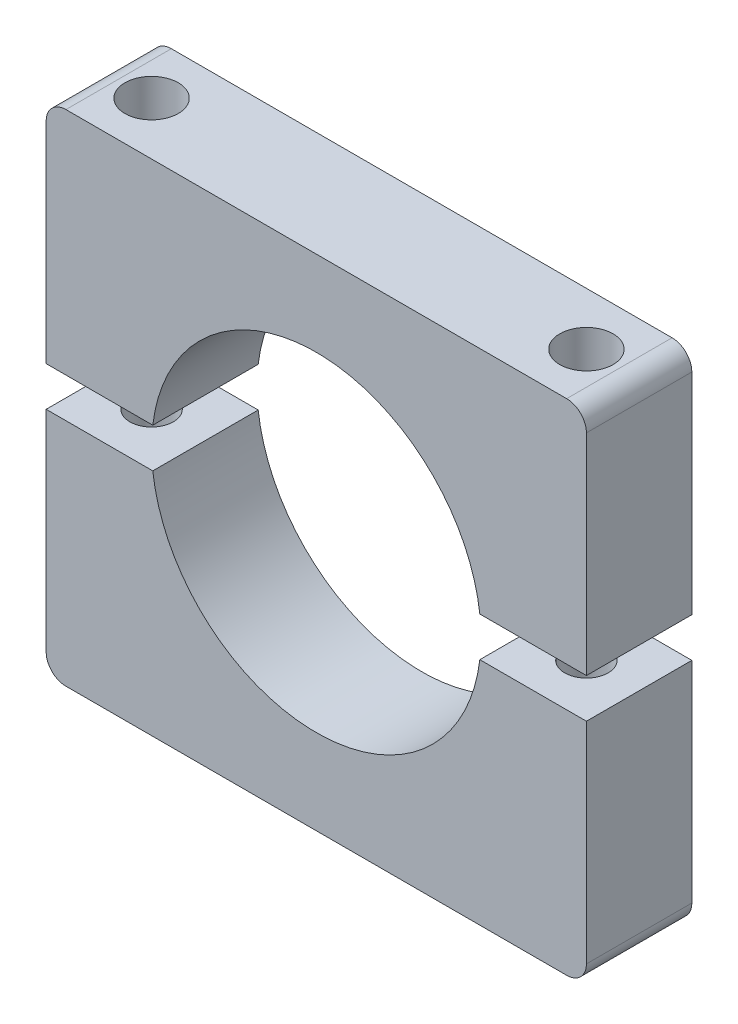
from build123d import *

# Parameters (mm, degrees)
SKETCH_1_W                  = 41
SKETCH_1_H                  = 37.9
SKETCH_1_R                  = 12.5
EXTRUDE_1_DEPTH             = 4
FILLET_1_R                  = 1.5
SKETCH_2_W                  = 50
SKETCH_2_H                  = 3
CUT_EXTRUDE_1_DEPTH         = 19
SKETCH_3_R                  = 2.025
CUT_EXTRUDE_2_DEPTH         = 19
SKETCH_5_W                  = 1.65
SKETCH_5_H                  = 17.45
HOLE_WIZARD_M4_1_AT_2_COUNT = 2
HOLE_WIZARD_M4_1_AT_2_PITCH = 33


with BuildPart() as part:
    # 草图1 → 凸台-拉伸1 (new, symmetric)
    with BuildSketch(Plane.XY):
        Rectangle(SKETCH_1_W, SKETCH_1_H)
        Circle(SKETCH_1_R, mode=Mode.SUBTRACT)
    extrude(amount=EXTRUDE_1_DEPTH, both=True)

    # 圆角1
    fillet_1_edges = [part.edges().sort_by_distance(p)[0] for p in [
        (20.5, -18.95, 0),
        (-20.5, -18.95, 0),
        (-20.5, 18.95, 0),
        (20.5, 18.95, 0),
    ]]
    fillet(fillet_1_edges, radius=FILLET_1_R)

    # 草图2 → 切除-拉伸1 (cut, symmetric)
    with BuildSketch(Plane.XY.offset(4)):
        Rectangle(SKETCH_2_W, SKETCH_2_H)
    extrude(amount=CUT_EXTRUDE_1_DEPTH, both=True, mode=Mode.SUBTRACT)


with BuildPart() as cut_extrude_1_piece_1:
    # of the separate pieces the step leaves, piece 1, a body of its own (cut_extrude_1_pieces)
    add(part.part.solids().sort_by_distance((-19, -18.95, -4))[0])

    # 草图5 → M4 螺纹孔1 (revolve, cut)
    with BuildSketch(Plane(origin=(-16.5, -1.5, 0), x_dir=(0, 0, 1), z_dir=(1, 0, 0))):
        with Locations((0.825, 8.725)):
            Rectangle(SKETCH_5_W, SKETCH_5_H)
    hole_wizard_m4_1 = revolve(axis=Axis((-16.5, 4.85, 0), (0, -1, 0)), mode=Mode.SUBTRACT)

    # M4 螺纹孔1 at 2: M4 螺纹孔1 ×2
    with Locations(*[(i * HOLE_WIZARD_M4_1_AT_2_PITCH, 0, 0) for i in range(1, HOLE_WIZARD_M4_1_AT_2_COUNT)]):
        add(hole_wizard_m4_1, mode=Mode.SUBTRACT)


with BuildPart() as cut_extrude_1_piece_2:
    # of the separate pieces the step leaves, piece 2, a body of its own (cut_extrude_1_pieces)
    add(part.part.solids().sort_by_distance((-20.5, 17.45, -4))[0])

    # 草图3 → 切除-拉伸2 (cut, symmetric)
    with BuildSketch(Plane(origin=(0, 18.95, 0), x_dir=(1, 0, 0), z_dir=(0, 1, 0))):
        with Locations(Location((16.5, 0, 0), (0, 0, 270))):
            Circle(SKETCH_3_R)
        with Locations(Location((-16.5, 0, 0), (0, 0, 270))):
            Circle(SKETCH_3_R)
    extrude(amount=CUT_EXTRUDE_2_DEPTH, both=True, mode=Mode.SUBTRACT)


solid = Compound([cut_extrude_1_piece_1.part, cut_extrude_1_piece_2.part])
